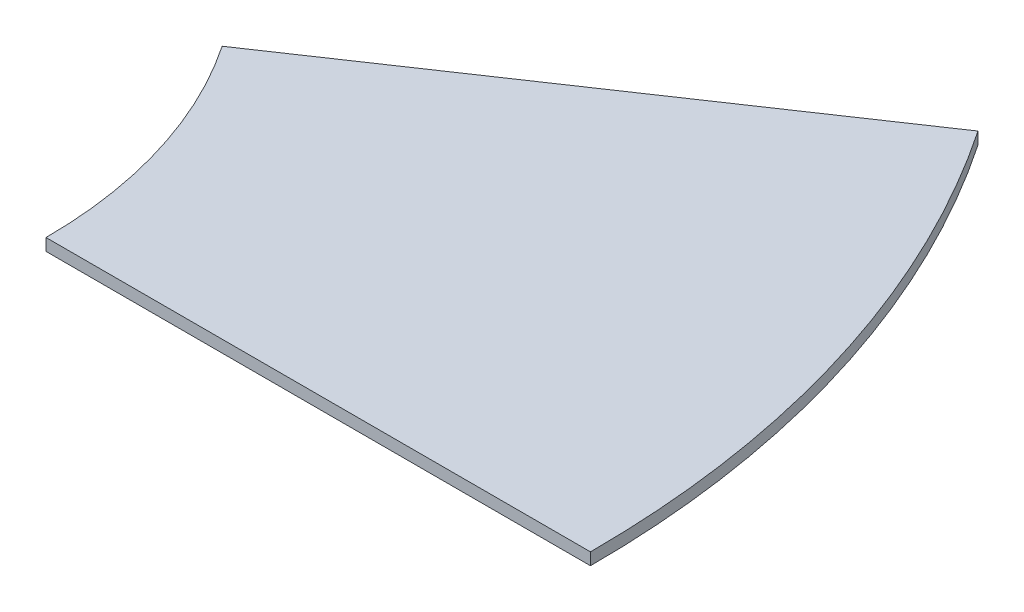
from build123d import *

# Parameters (mm, degrees)
EXTRUDE_1_DEPTH = 1.33


with BuildPart() as part:
    # 草图1 → 凸台-拉伸1 (new body)
    with BuildSketch(Plane(origin=(0, 0, 0), x_dir=(1, 0, 0), z_dir=(0, 1, 0))):
        with BuildLine():
            Line((91.194132981, 61.511219382), (41.451878628, 27.959645174))
            ThreePointArc((41.451878628, 27.959645174), (47.815237798, 14.618585236), (50, 0))
            Line((50, 0), (110, 0))
            ThreePointArc((110, 0), (105.193523156, 32.16088752), (91.194132981, 61.511219382))
        make_face()
    extrude(amount=EXTRUDE_1_DEPTH)


solid = part.part
